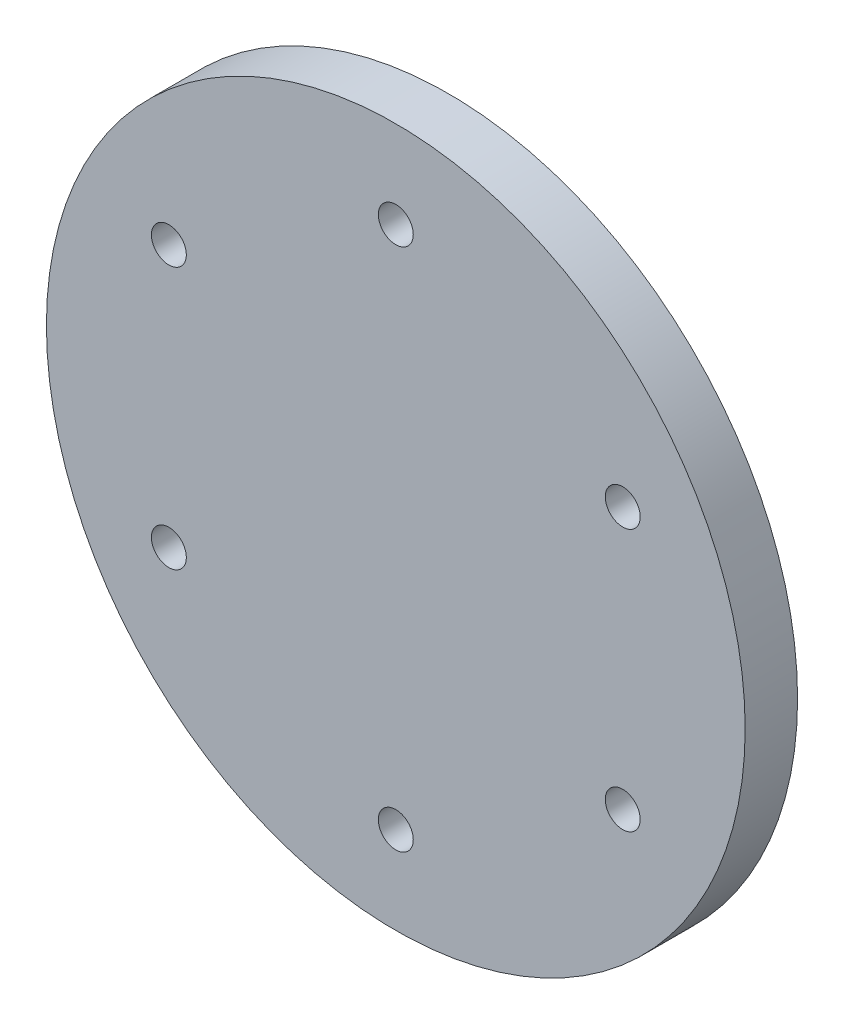
from build123d import *

# Parameters (mm, degrees)
SKETCH1_R           = 40
BOSS_EXTRUDE1_DEPTH = 6
SKETCH2_R           = 2
CUT_EXTRUDE1_DEPTH  = 57.885850613


with BuildPart() as part:
    # Sketch1 → Boss-Extrude1 (new body)
    with BuildSketch(Plane.XY):
        Circle(SKETCH1_R)
    extrude(amount=BOSS_EXTRUDE1_DEPTH)

    # Sketch2 → Cut-Extrude1 (cut, through all)
    with BuildSketch(Plane.XY):
        with Locations((0, 30)):
            Circle(SKETCH2_R)
        with Locations((25.980762114, 15)):
            Circle(SKETCH2_R)
        with Locations((25.980762114, -15)):
            Circle(SKETCH2_R)
        with Locations((0, -30)):
            Circle(SKETCH2_R)
        with Locations((-25.980762114, -15)):
            Circle(SKETCH2_R)
        with Locations((-25.980762114, 15)):
            Circle(SKETCH2_R)
    extrude(amount=CUT_EXTRUDE1_DEPTH, mode=Mode.SUBTRACT)


solid = part.part
